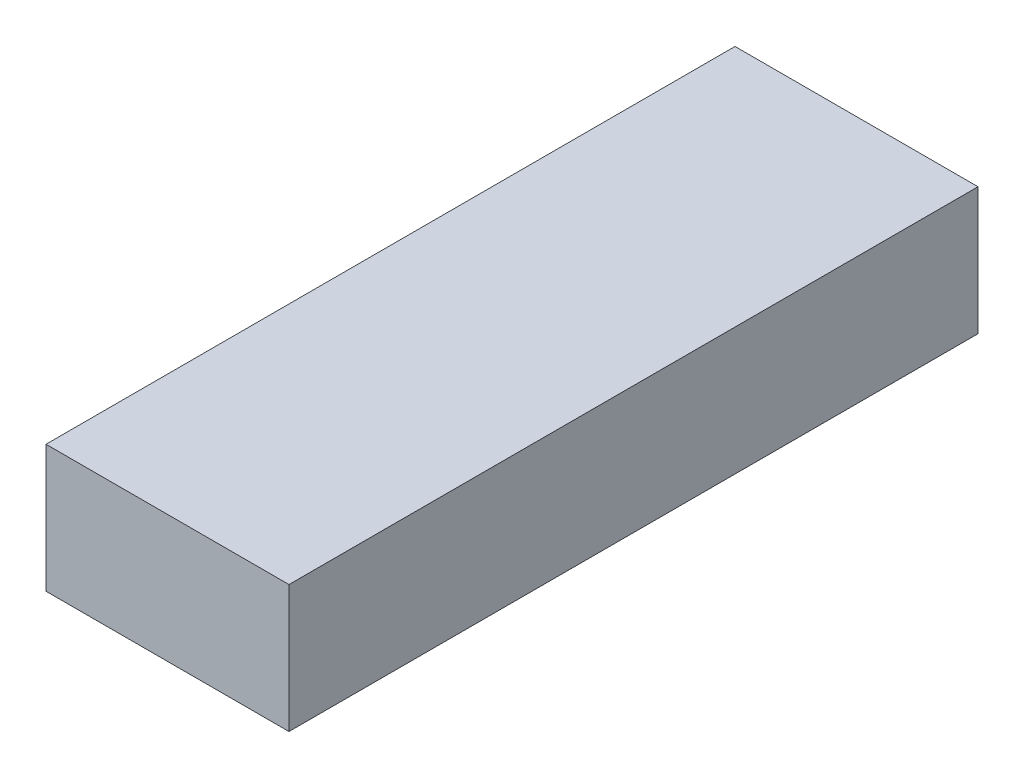
from build123d import *

# Parameters (mm, degrees)
SKETCH1_W           = 584
SKETCH1_H           = 1656
BOSS_EXTRUDE1_DEPTH = 306


with BuildPart() as part:
    # Sketch1 → Boss-Extrude1 (new body)
    with BuildSketch(Plane(origin=(0, 0, 0), x_dir=(1, 0, 0), z_dir=(0, 1, 0))):
        Rectangle(SKETCH1_W, SKETCH1_H)
    extrude(amount=BOSS_EXTRUDE1_DEPTH)


solid = part.part
